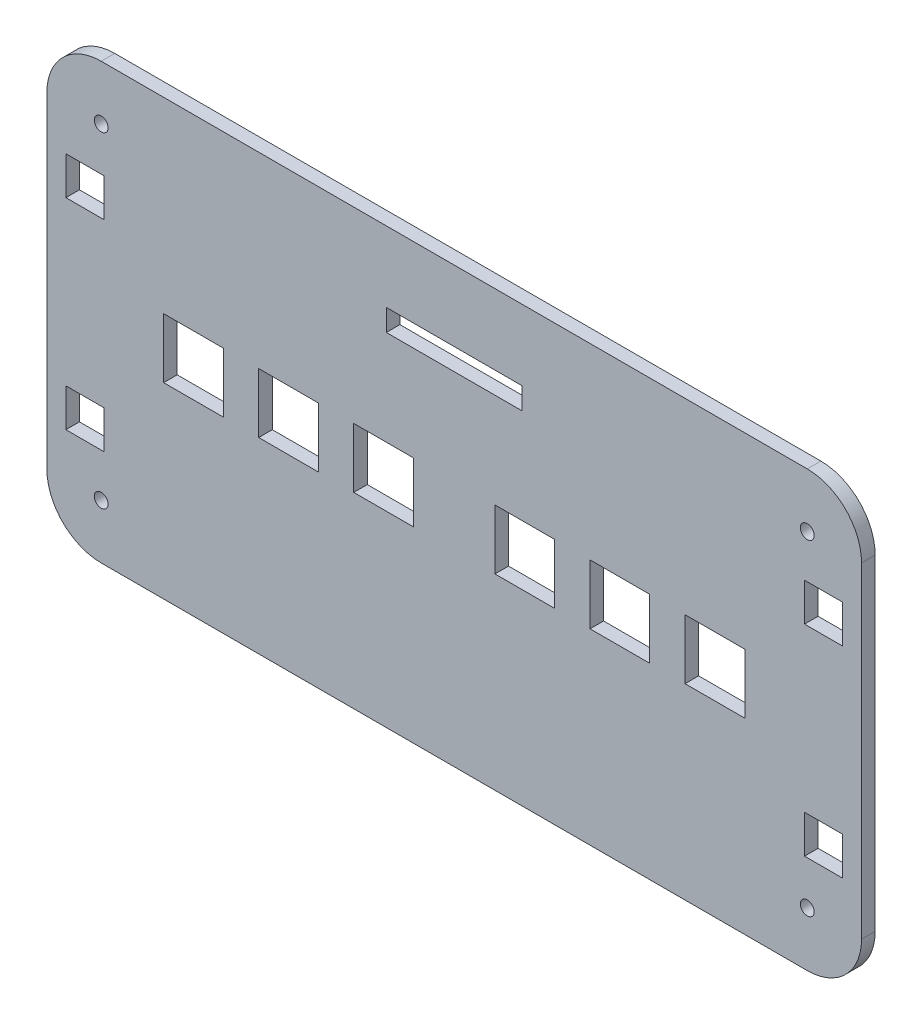
from build123d import *

# Parameters (mm, degrees)
SKETCH_2_R      = 2.55
SKETCH_2_W      = 22
SKETCH_2_H      = 22
SKETCH_2_W_2    = 14
SKETCH_2_H_2    = 14
SKETCH_2_W_3    = 50
SKETCH_2_H_3    = 8
EXTRUDE_1_DEPTH = 5


with BuildPart() as part:
    # 草图2 → 凸台-拉伸1 (new body)
    with BuildSketch(Plane.XY):
        with BuildLine():
            Line((-130, -130), (130, -130))
            ThreePointArc((130, -130), (144.142135624, -124.142135624), (150, -110))
            Line((150, -110), (150, 10))
            ThreePointArc((150, 10), (144.142135624, 24.142135624), (130, 30))
            Line((130, 30), (-130, 30))
            ThreePointArc((-130, 30), (-144.142135624, 24.142135624), (-150, 10))
            Line((-150, 10), (-150, -110))
            ThreePointArc((-150, -110), (-144.142135624, -124.142135624), (-130, -130))
        make_face()
        with Locations((130, -110)):
            Circle(SKETCH_2_R, mode=Mode.SUBTRACT)
        with Locations((130, 10)):
            Circle(SKETCH_2_R, mode=Mode.SUBTRACT)
        with Locations((-130, -110)):
            Circle(SKETCH_2_R, mode=Mode.SUBTRACT)
        with Locations((-130, 10)):
            Circle(SKETCH_2_R, mode=Mode.SUBTRACT)
        with Locations((-61, -50)):
            Rectangle(SKETCH_2_W, SKETCH_2_H, mode=Mode.SUBTRACT)
        with Locations((-26, -50)):
            Rectangle(SKETCH_2_W, SKETCH_2_H, mode=Mode.SUBTRACT)
        with Locations((26, -50)):
            Rectangle(SKETCH_2_W, SKETCH_2_H, mode=Mode.SUBTRACT)
        with Locations((136, -87)):
            Rectangle(SKETCH_2_W_2, SKETCH_2_H_2, mode=Mode.SUBTRACT)
        with Locations((136, -13)):
            Rectangle(SKETCH_2_W_2, SKETCH_2_H_2, mode=Mode.SUBTRACT)
        Rectangle(SKETCH_2_W_3, SKETCH_2_H_3, mode=Mode.SUBTRACT)
        with Locations((-136, -87)):
            Rectangle(SKETCH_2_W_2, SKETCH_2_H_2, mode=Mode.SUBTRACT)
        with Locations((-136, -13)):
            Rectangle(SKETCH_2_W_2, SKETCH_2_H_2, mode=Mode.SUBTRACT)
        with Locations((-96, -50)):
            Rectangle(SKETCH_2_W, SKETCH_2_H, mode=Mode.SUBTRACT)
        with Locations((61, -50)):
            Rectangle(SKETCH_2_W, SKETCH_2_H, mode=Mode.SUBTRACT)
        with Locations((96, -50)):
            Rectangle(SKETCH_2_W, SKETCH_2_H, mode=Mode.SUBTRACT)
    extrude(amount=EXTRUDE_1_DEPTH)


solid = part.part
